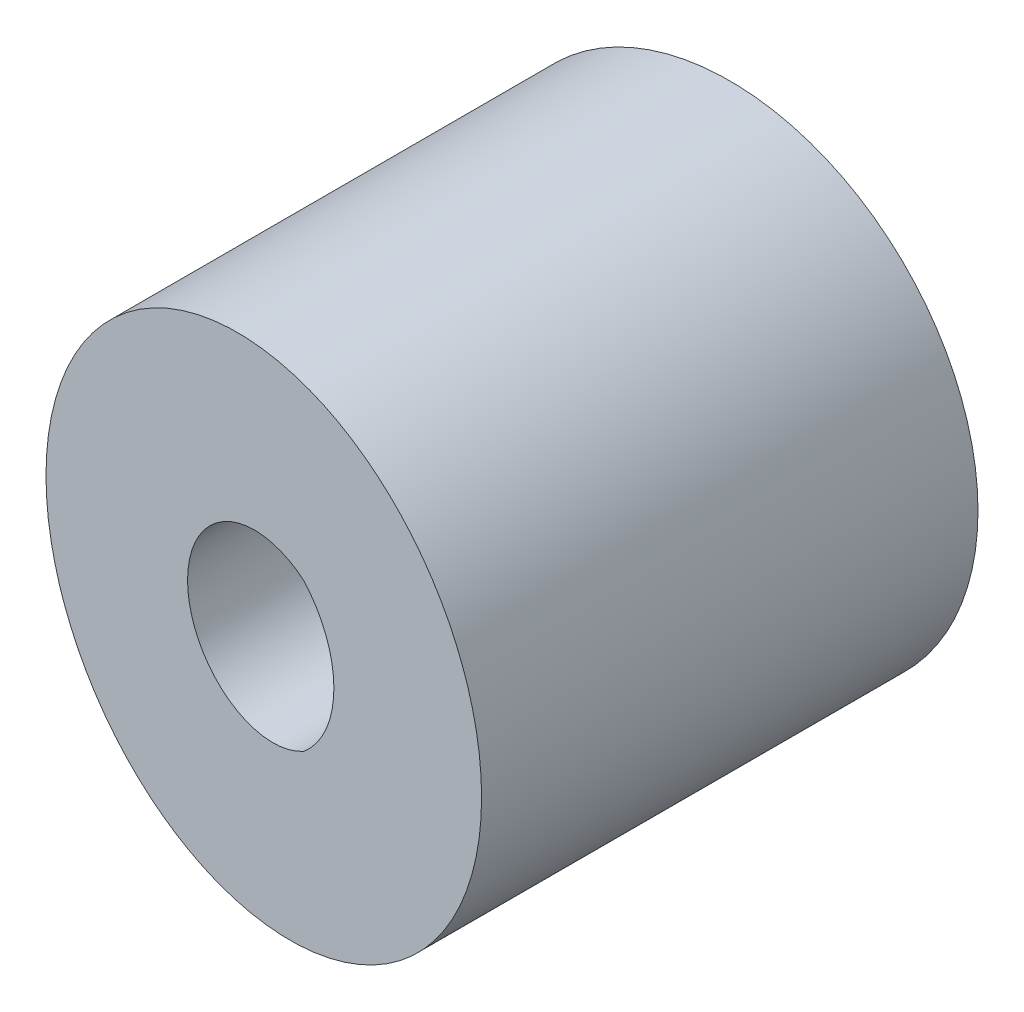
from build123d import *

# Parameters (mm, degrees)
SKETCH1_R                 = 10
BOSS_EXTRUDE1_DEPTH       = 20
CUT_EXTRUDE1_DEPTH        = 103
M8X1_0_TAPPED_HOLE1_D     = 7
M8X1_0_TAPPED_HOLE1_DEPTH = 19
M8X1_0_TAPPED_HOLE1_TIP   = 2.103012167


with BuildPart() as part:
    # Sketch1 → Boss-Extrude1 (new body)
    with BuildSketch(Plane.XY):
        Circle(SKETCH1_R)
    extrude(amount=BOSS_EXTRUDE1_DEPTH)

    # Sketch2 → Cut-Extrude1 (cut, symmetric)
    with BuildSketch(Plane(origin=(0, 0, 0), x_dir=(1, 0, 0), z_dir=(0, 1, 0))):
        Polygon((-175.190419067, 2.685826336), (24.809580933, -21.814173664), (24.809580933, -148.814173664), (-175.190419067, -173.314173664), align=None)
    extrude(amount=CUT_EXTRUDE1_DEPTH, both=True, mode=Mode.SUBTRACT)

    # M8x1.0 Tapped Hole1
    with Locations(Plane(origin=(0, 0, 0), x_dir=(-1, 0, 0), z_dir=(0, 0, -1))):
        with Locations((0, 0)):
            Hole(M8X1_0_TAPPED_HOLE1_D / 2, depth=M8X1_0_TAPPED_HOLE1_DEPTH)
            with Locations((0, 0, -(M8X1_0_TAPPED_HOLE1_DEPTH + M8X1_0_TAPPED_HOLE1_TIP / 2))):  # 118° drill point
                Cone(0, M8X1_0_TAPPED_HOLE1_D / 2, M8X1_0_TAPPED_HOLE1_TIP, mode=Mode.SUBTRACT)


solid = part.part
